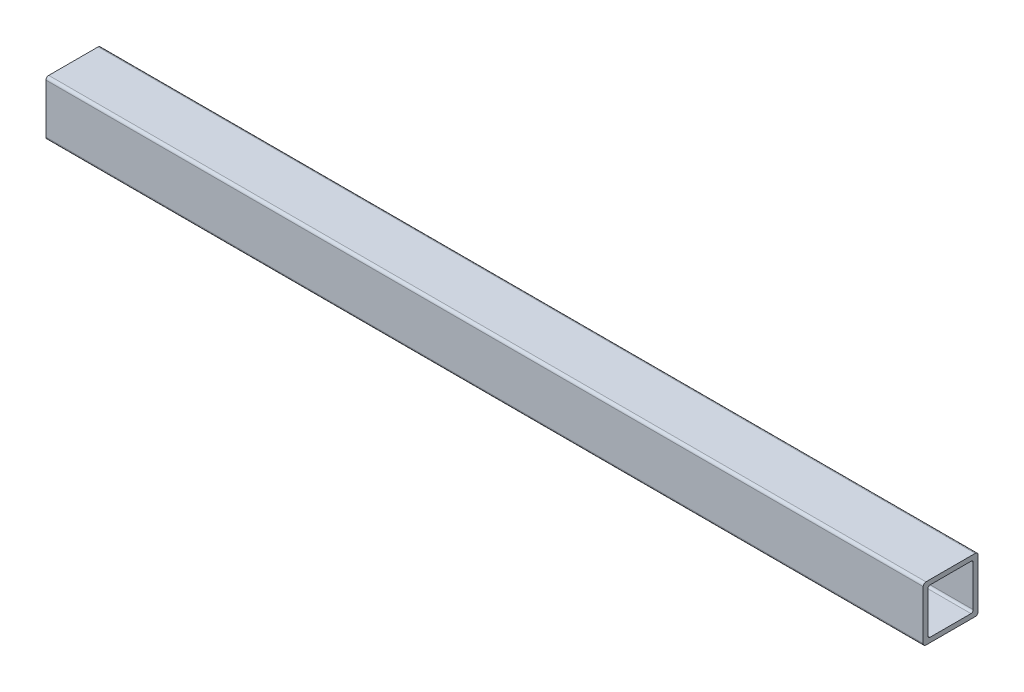
from build123d import *

# Parameters (mm, degrees)
BOSS_EXTRUDE1_DEPTH      = 152.4
BOSS_EXTRUDE1_DEPTH_BACK = 152.4


with BuildPart() as part:
    # Sketch4 → Boss-Extrude1 (new, two sides: drawn at the far end of the back side and taken through both)
    with BuildSketch(Plane(origin=(0, 0, 0), x_dir=(0, 0, -1), z_dir=(1, 0, 0)).offset(-BOSS_EXTRUDE1_DEPTH_BACK)):
        with BuildLine():
            Line((9.525, -8.5725), (9.525, 8.5725))
            ThreePointArc((9.525, 8.5725), (9.246019209, 9.246019209), (8.5725, 9.525))
            Line((8.5725, 9.525), (-8.5725, 9.525))
            ThreePointArc((-8.5725, 9.525), (-9.246019209, 9.246019209), (-9.525, 8.5725))
            Line((-9.525, 8.5725), (-9.525, -8.5725))
            ThreePointArc((-9.525, -8.5725), (-9.246019209, -9.246019209), (-8.5725, -9.525))
            Line((-8.5725, -9.525), (8.5725, -9.525))
            ThreePointArc((8.5725, -9.525), (9.246019209, -9.246019209), (9.525, -8.5725))
        make_face()
        with BuildLine():
            Line((7.874, 7.0866), (7.874, -7.0866))
            ThreePointArc((7.874, -7.0866), (7.64337588, -7.64337588), (7.0866, -7.874))
            Line((7.0866, -7.874), (-7.0866, -7.874))
            ThreePointArc((-7.0866, -7.874), (-7.64337588, -7.64337588), (-7.874, -7.0866))
            Line((-7.874, -7.0866), (-7.874, 7.0866))
            ThreePointArc((-7.874, 7.0866), (-7.64337588, 7.64337588), (-7.0866, 7.874))
            Line((-7.0866, 7.874), (7.0866, 7.874))
            ThreePointArc((7.0866, 7.874), (7.64337588, 7.64337588), (7.874, 7.0866))
        make_face(mode=Mode.SUBTRACT)
    extrude(amount=BOSS_EXTRUDE1_DEPTH + BOSS_EXTRUDE1_DEPTH_BACK)


solid = part.part
